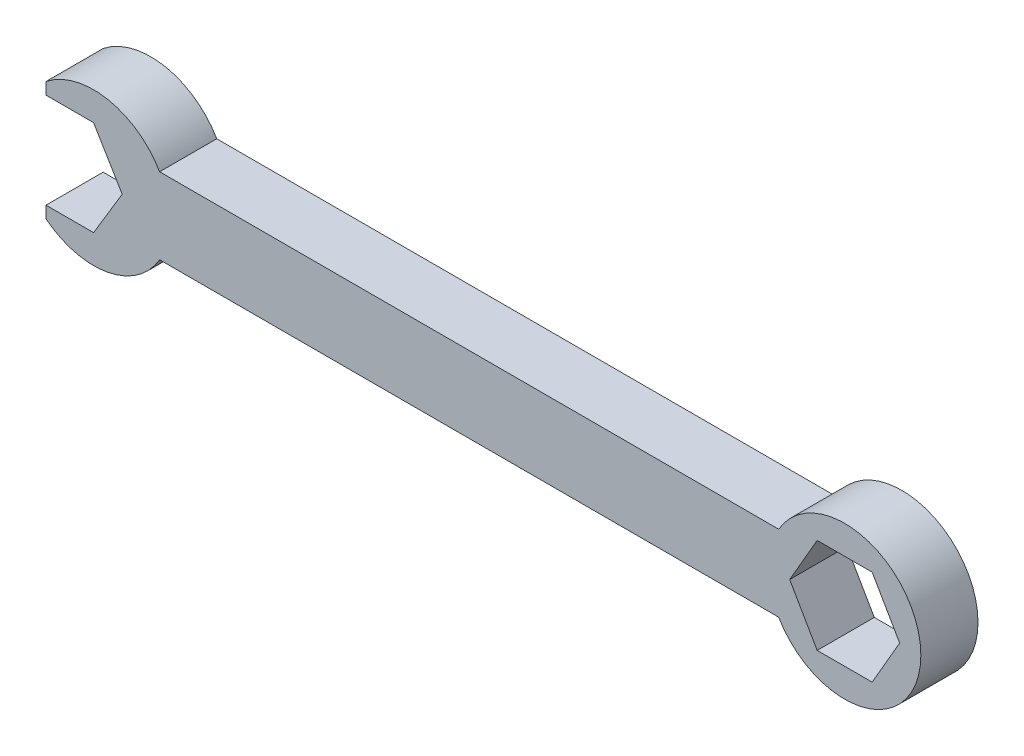
from build123d import *

# Parameters (mm, degrees)
SZKIC2_R                    = 10.16
DODANIE_WYCI_GNI_CIE2_DEPTH = 7.62


with BuildPart() as part:
    # Szkic2 → Dodanie-wyciągnięcie2 (new body)
    # profile 1 of 3: a face of its own
    with BuildSketch(Plane.XY):
        with BuildLine():
            ThreePointArc((-10.16, -7.931147458), (6.35, 0), (-10.16, 7.931147458))
            Line((-10.16, 7.931147458), (-10.16, 6.35))
            Line((-10.16, 6.35), (-3.81, 6.35))
            Line((-3.81, 6.35), (0, 0))
            Line((0, 0), (-3.81, -6.35))
            Line((-3.81, -6.35), (-10.16, -6.35))
            Line((-10.16, -6.35), (-10.16, -7.931147458))
        make_face()
    # profile 2 of 3: a face of its own
    with BuildSketch(Plane.XY):
        with BuildLine():
            Line((87.538818102, 5.08), (4.988818102, 5.08))
            ThreePointArc((4.988818102, 5.08), (6.35, 0), (4.988818102, -5.08))
            Line((4.988818102, -5.08), (87.538818102, -5.08))
            ThreePointArc((87.538818102, -5.08), (86.177636205, 0), (87.538818102, 5.08))
        make_face()
    # profile 3 of 3: a face of its own
    with BuildSketch(Plane.XY):
        with Locations((96.337636205, 0)):
            Circle(SZKIC2_R)
        Polygon((100.003810414, -6.35), (103.669984624, 0), (100.003810414, 6.35), (92.671461996, 6.35), (89.005287786, 0), (92.671461996, -6.35), align=None, mode=Mode.SUBTRACT)
    extrude(amount=DODANIE_WYCI_GNI_CIE2_DEPTH)


solid = part.part
